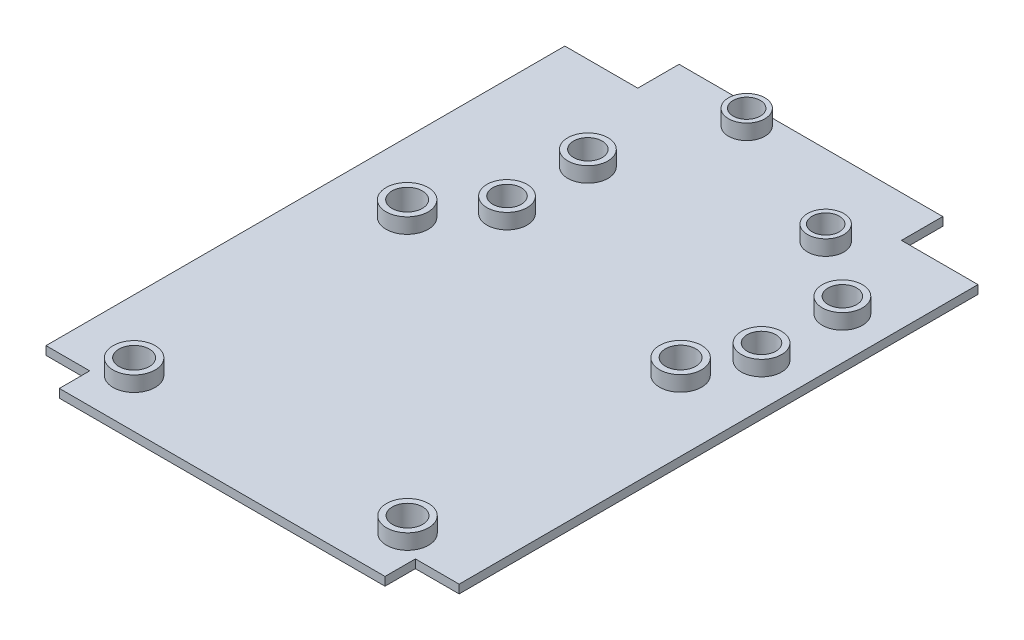
from build123d import *

# Parameters (mm, degrees)
SKETCH1_R           = 4.4
SKETCH1_R_2         = 4.2
SKETCH1_R_3         = 3.8
BOSS_EXTRUDE2_DEPTH = 1.778
SKETCH1_4_R         = 4.2
SKETCH1_4_R_2       = 3
SKETCH1_4_R_3       = 4.4
SKETCH1_4_R_4       = 3.175
SKETCH1_4_R_5       = 3.8
SKETCH1_4_R_6       = 2.8448
BOSS_EXTRUDE3_DEPTH = 4.953


with BuildPart() as part:
    # Sketch1 → Boss-Extrude2 (new body)
    with BuildSketch(Plane(origin=(0, 0, 0), x_dir=(1, 0, 0), z_dir=(0, 1, 0))):
        Polygon((-42.232830982, -41.594410903), (-33.088830982, -41.594410903), (-33.088830982, -47.944410903), (34.983169018, -47.944410903), (34.983169018, -41.594410903), (44.127169018, -41.594410903), (44.127169018, 66.863589097), (43.365169018, 66.863589097), (28.125169018, 66.863589097), (28.125169018, 75.499589097), (-26.992830982, 75.499589097), (-26.992830982, 66.863589097), (-42.232830982, 66.863589097), align=None)
        with Locations(Location((-27.642783289, -37.764613693, 0), (0, 0, 270))):
            Circle(SKETCH1_R, mode=Mode.SUBTRACT)
        with Locations(Location((29.507278107, -37.764613693, 0), (0, 0, 270))):
            Circle(SKETCH1_R, mode=Mode.SUBTRACT)
        with Locations(Location((-27.731568772, 19.395386307, 0), (0, 0, 270))):
            Circle(SKETCH1_R, mode=Mode.SUBTRACT)
        with Locations(Location((-17.958983642, 30.494821479, 0), (0, 0, 270))):
            Circle(SKETCH1_R_2, mode=Mode.SUBTRACT)
        with Locations(Location((-17.958983642, 47.403601479, 0), (0, 0, 270))):
            Circle(SKETCH1_R_2, mode=Mode.SUBTRACT)
        with Locations(Location((-8.7905296, 71.432825816, 0), (0, 0, 270))):
            Circle(SKETCH1_R_3, mode=Mode.SUBTRACT)
        with Locations(Location((29.428492634, 19.395386307, 0), (0, 0, 270))):
            Circle(SKETCH1_R, mode=Mode.SUBTRACT)
        with Locations(Location((35.241316358, 30.494821479, 0), (0, 0, 270))):
            Circle(SKETCH1_R_2, mode=Mode.SUBTRACT)
        with Locations(Location((20.4194704, 58.732825816, 0), (0, 0, 270))):
            Circle(SKETCH1_R_3, mode=Mode.SUBTRACT)
        with Locations(Location((35.241316358, 47.403601479, 0), (0, 0, 270))):
            Circle(SKETCH1_R_2, mode=Mode.SUBTRACT)
    extrude(amount=BOSS_EXTRUDE2_DEPTH)

    # Sketch1<4> → Boss-Extrude3 (add)
    # profile 1 of 10: a face of its own
    with BuildSketch(Plane(origin=(0, 0, 0), x_dir=(1, 0, 0), z_dir=(0, 1, 0))):
        with Locations(Location((-17.958983642, 47.403601479, 0), (0, 0, 270))):
            Circle(SKETCH1_4_R)
        with Locations(Location((-17.958983642, 47.403601479, 0), (0, 0, 270))):
            Circle(SKETCH1_4_R_2, mode=Mode.SUBTRACT)
    # profile 2 of 10: a face of its own
    with BuildSketch(Plane(origin=(0, 0, 0), x_dir=(1, 0, 0), z_dir=(0, 1, 0))):
        with Locations(Location((-17.958983642, 30.494821479, 0), (0, 0, 270))):
            Circle(SKETCH1_4_R)
        with Locations(Location((-17.958983642, 30.494821479, 0), (0, 0, 270))):
            Circle(SKETCH1_4_R_2, mode=Mode.SUBTRACT)
    # profile 3 of 10: a face of its own
    with BuildSketch(Plane(origin=(0, 0, 0), x_dir=(1, 0, 0), z_dir=(0, 1, 0))):
        with Locations(Location((35.241316358, 47.403601479, 0), (0, 0, 270))):
            Circle(SKETCH1_4_R)
        with Locations(Location((35.241316358, 47.403601479, 0), (0, 0, 270))):
            Circle(SKETCH1_4_R_2, mode=Mode.SUBTRACT)
    # profile 4 of 10: a face of its own
    with BuildSketch(Plane(origin=(0, 0, 0), x_dir=(1, 0, 0), z_dir=(0, 1, 0))):
        with Locations(Location((35.241316358, 30.494821479, 0), (0, 0, 270))):
            Circle(SKETCH1_4_R)
        with Locations(Location((35.241316358, 30.494821479, 0), (0, 0, 270))):
            Circle(SKETCH1_4_R_2, mode=Mode.SUBTRACT)
    # profile 5 of 10: a face of its own
    with BuildSketch(Plane(origin=(0, 0, 0), x_dir=(1, 0, 0), z_dir=(0, 1, 0))):
        with Locations(Location((-27.731568772, 19.395386307, 0), (0, 0, 270))):
            Circle(SKETCH1_4_R_3)
        with Locations(Location((-27.731568772, 19.395386307, 0), (0, 0, 270))):
            Circle(SKETCH1_4_R_4, mode=Mode.SUBTRACT)
    # profile 6 of 10: a face of its own
    with BuildSketch(Plane(origin=(0, 0, 0), x_dir=(1, 0, 0), z_dir=(0, 1, 0))):
        with Locations(Location((-27.642783289, -37.764613693, 0), (0, 0, 270))):
            Circle(SKETCH1_4_R_3)
        with Locations(Location((-27.642783289, -37.764613693, 0), (0, 0, 270))):
            Circle(SKETCH1_4_R_4, mode=Mode.SUBTRACT)
    # profile 7 of 10: a face of its own
    with BuildSketch(Plane(origin=(0, 0, 0), x_dir=(1, 0, 0), z_dir=(0, 1, 0))):
        with Locations(Location((29.507278107, -37.764613693, 0), (0, 0, 270))):
            Circle(SKETCH1_4_R_3)
        with Locations(Location((29.507278107, -37.764613693, 0), (0, 0, 270))):
            Circle(SKETCH1_4_R_4, mode=Mode.SUBTRACT)
    # profile 8 of 10: a face of its own
    with BuildSketch(Plane(origin=(0, 0, 0), x_dir=(1, 0, 0), z_dir=(0, 1, 0))):
        with Locations(Location((29.428492634, 19.395386307, 0), (0, 0, 270))):
            Circle(SKETCH1_4_R_3)
        with Locations(Location((29.428492634, 19.395386307, 0), (0, 0, 270))):
            Circle(SKETCH1_4_R_4, mode=Mode.SUBTRACT)
    # profile 9 of 10: a face of its own
    with BuildSketch(Plane(origin=(0, 0, 0), x_dir=(1, 0, 0), z_dir=(0, 1, 0))):
        with Locations(Location((-8.7905296, 71.432825816, 0), (0, 0, 270))):
            Circle(SKETCH1_4_R_5)
        with Locations(Location((-8.7905296, 71.432825816, 0), (0, 0, 270))):
            Circle(SKETCH1_4_R_6, mode=Mode.SUBTRACT)
    # profile 10 of 10: a face of its own
    with BuildSketch(Plane(origin=(0, 0, 0), x_dir=(1, 0, 0), z_dir=(0, 1, 0))):
        with Locations(Location((20.4194704, 58.732825816, 0), (0, 0, 270))):
            Circle(SKETCH1_4_R_5)
        with Locations(Location((20.4194704, 58.732825816, 0), (0, 0, 270))):
            Circle(SKETCH1_4_R_6, mode=Mode.SUBTRACT)
    extrude(amount=BOSS_EXTRUDE3_DEPTH)


solid = part.part
